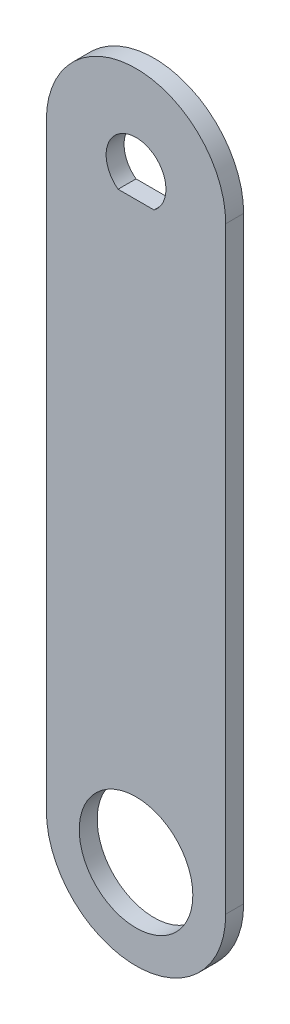
from build123d import *

# Parameters (mm, degrees)
SKETCH_1_R      = 9.5
EXTRUDE_1_DEPTH = 3


with BuildPart() as part:
    # 草图1 → 凸台-拉伸1 (new body)
    with BuildSketch(Plane.XY):
        with BuildLine():
            Line((-15, 0), (-15, -100))
            ThreePointArc((-15, -100), (0, -115), (15, -100))
            Line((15, -100), (15, 0))
            ThreePointArc((15, 0), (0, 15), (-15, 0))
        make_face()
        with Locations((0, -100)):
            Circle(SKETCH_1_R, mode=Mode.SUBTRACT)
        with BuildLine():
            Line((0, -4), (3, -4))
            ThreePointArc((3, -4), (0, 5), (-3, -4))
            Line((-3, -4), (0, -4))
        make_face(mode=Mode.SUBTRACT)
    extrude(amount=EXTRUDE_1_DEPTH)


solid = part.part
